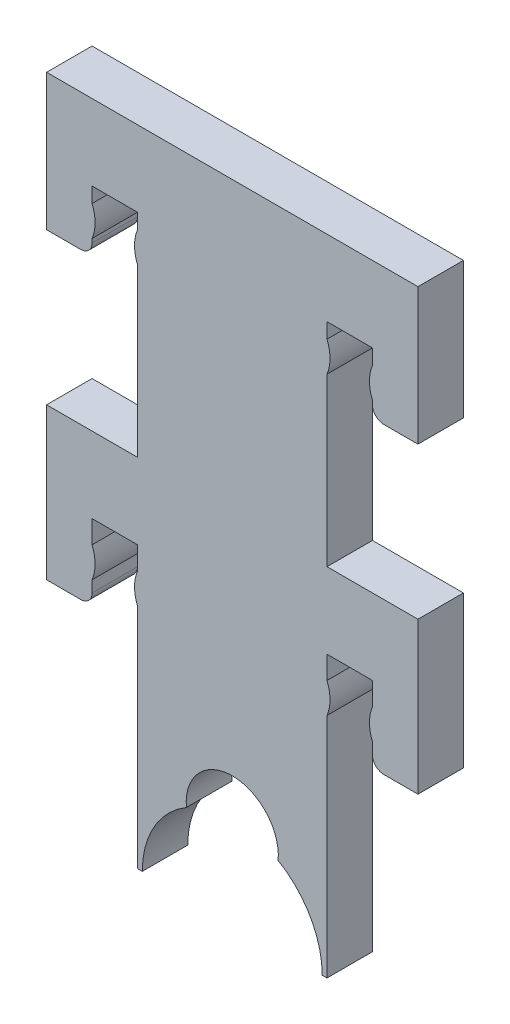
from build123d import *

# Parameters (mm, degrees)
BOSS_EXTRUDE1_DEPTH = 3
FILLET1_R           = 0.75


with BuildPart() as part:
    # Sketch1 → Boss-Extrude1 (new body)
    with BuildSketch(Plane.XY):
        with BuildLine():
            Line((12.840070534, 24.147116385), (-11.659929466, 24.147116385))
            Line((-11.659929466, 24.147116385), (-11.659929466, 15.147116385))
            Line((-11.659929466, 15.147116385), (-8.659929466, 15.147116385))
            Line((-8.659929466, 15.147116385), (-8.659929466, 16.147116385))
            ThreePointArc((-8.659929466, 16.147116385), (-8.459929466, 17.147116385), (-8.659929466, 18.147116385))
            Line((-8.659929466, 18.147116385), (-8.659929466, 19.147116385))
            Line((-8.659929466, 19.147116385), (-5.659929466, 19.147116385))
            Line((-5.659929466, 19.147116385), (-5.659929466, 18.147116385))
            ThreePointArc((-5.659929466, 18.147116385), (-5.859929466, 17.147116385), (-5.659929466, 16.147116385))
            Line((-5.659929466, 16.147116385), (-5.659929466, 5.147116385))
            Line((-5.659929466, 5.147116385), (-11.659929466, 5.147116385))
            Line((-11.659929466, 5.147116385), (-11.659929466, -4.852883615))
            Line((-11.659929466, -4.852883615), (-8.659929466, -4.852883615))
            Line((-8.659929466, -4.852883615), (-8.659929466, -3.352883615))
            ThreePointArc((-8.659929466, -3.352883615), (-8.459929466, -2.352883615), (-8.659929466, -1.352883615))
            Line((-8.659929466, -1.352883615), (-8.659929466, 0.147116385))
            Line((-8.659929466, 0.147116385), (-5.659929466, 0.147116385))
            Line((-5.659929466, 0.147116385), (-5.659929466, -1.352883615))
            ThreePointArc((-5.659929466, -1.352883615), (-5.859929466, -2.352883615), (-5.659929466, -3.352883615))
            Line((-5.659929466, -3.352883615), (-5.659929466, -18.352883615))
            Line((-5.659929466, -18.352883615), (-5.344929466, -18.352883615))
            ThreePointArc((-5.344929466, -18.352883615), (-4.566833019, -15.415100311), (-2.436565272, -13.247621556))
            ThreePointArc((-2.436565272, -13.247621556), (0.447544838, -9.926226501), (3.630070534, -12.962883615))
            ThreePointArc((3.630070534, -12.962883615), (3.626727648, -13.105409311), (3.616706341, -13.247621556))
            ThreePointArc((3.616706341, -13.247621556), (5.746974087, -15.415100311), (6.525070534, -18.352883615))
            Line((6.525070534, -18.352883615), (6.840070534, -18.352883615))
            Line((6.840070534, -18.352883615), (6.840070534, -3.352883615))
            ThreePointArc((6.840070534, -3.352883615), (7.040070534, -2.352883615), (6.840070534, -1.352883615))
            Line((6.840070534, -1.352883615), (6.840070534, 0.147116385))
            Line((6.840070534, 0.147116385), (9.840070534, 0.147116385))
            Line((9.840070534, 0.147116385), (9.840070534, -1.352883615))
            ThreePointArc((9.840070534, -1.352883615), (9.640070534, -2.352883615), (9.840070534, -3.352883615))
            Line((9.840070534, -3.352883615), (9.840070534, -4.852883615))
            Line((9.840070534, -4.852883615), (12.840070534, -4.852883615))
            Line((12.840070534, -4.852883615), (12.840070534, 5.147116385))
            Line((12.840070534, 5.147116385), (6.840070534, 5.147116385))
            Line((6.840070534, 5.147116385), (6.840070534, 16.147116385))
            ThreePointArc((6.840070534, 16.147116385), (7.040070534, 17.147116385), (6.840070534, 18.147116385))
            Line((6.840070534, 18.147116385), (6.840070534, 19.147116385))
            Line((6.840070534, 19.147116385), (9.840070534, 19.147116385))
            Line((9.840070534, 19.147116385), (9.840070534, 18.147116385))
            ThreePointArc((9.840070534, 18.147116385), (9.640070534, 17.147116385), (9.840070534, 16.147116385))
            Line((9.840070534, 16.147116385), (9.840070534, 15.147116385))
            Line((9.840070534, 15.147116385), (12.840070534, 15.147116385))
            Line((12.840070534, 15.147116385), (12.840070534, 24.147116385))
        make_face()
    extrude(amount=BOSS_EXTRUDE1_DEPTH)

    # Fillet1
    fillet1_edges = [part.edges().sort_by_distance(p)[0] for p in [
        (-8.659929466, 15.147116385, 1.5),
        (9.840070534, 15.147116385, 1.5),
        (9.840070534, -4.852883615, 1.5),
        (-8.659929466, -4.852883615, 1.5),
    ]]
    fillet(fillet1_edges, radius=FILLET1_R)


solid = part.part
